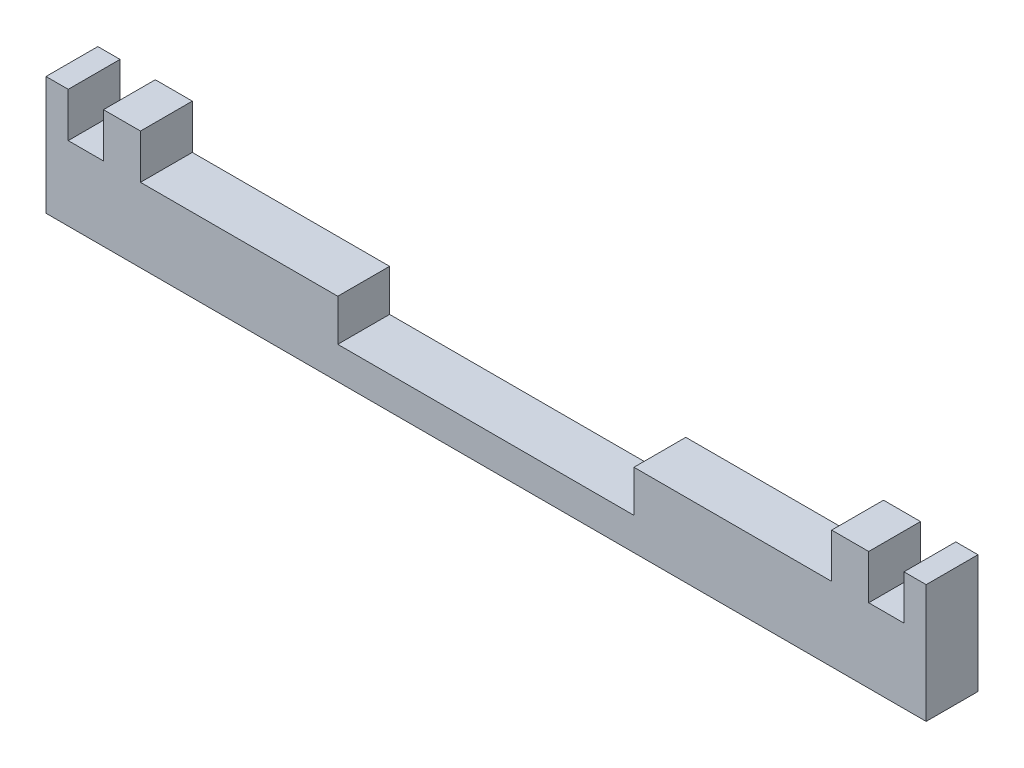
from build123d import *

# Parameters (mm, degrees)
BOSS_EXTRUDE1_DEPTH = 8.89
SKETCH2_W           = 50.8
SKETCH2_H           = 7.14375
CUT_EXTRUDE1_DEPTH  = 8.89


with BuildPart() as part:
    # Sketch1 → Boss-Extrude1 (new body)
    with BuildSketch(Plane.XY):
        Polygon((-95.447161757, -23.697149871), (55.505038243, -23.697149871), (55.505038243, -3.377149871), (51.695038243, -3.377149871), (51.695038243, -10.997149871), (45.649838243, -10.997149871), (45.649838243, -3.377149871), (39.299838243, -3.377149871), (39.299838243, -10.997149871), (-79.241961757, -10.997149871), (-79.241961757, -3.377149871), (-85.591961757, -3.377149871), (-85.591961757, -10.997149871), (-91.637161757, -10.997149871), (-91.637161757, -3.377149871), (-95.447161757, -3.377149871), align=None)
    extrude(amount=BOSS_EXTRUDE1_DEPTH)

    # Sketch2 → Cut-Extrude1 (cut)
    with BuildSketch(Plane.XY.offset(8.89)):
        with Locations((-20.009161757, -14.569024871)):
            Rectangle(SKETCH2_W, SKETCH2_H)
    extrude(amount=-CUT_EXTRUDE1_DEPTH, mode=Mode.SUBTRACT)


solid = part.part
